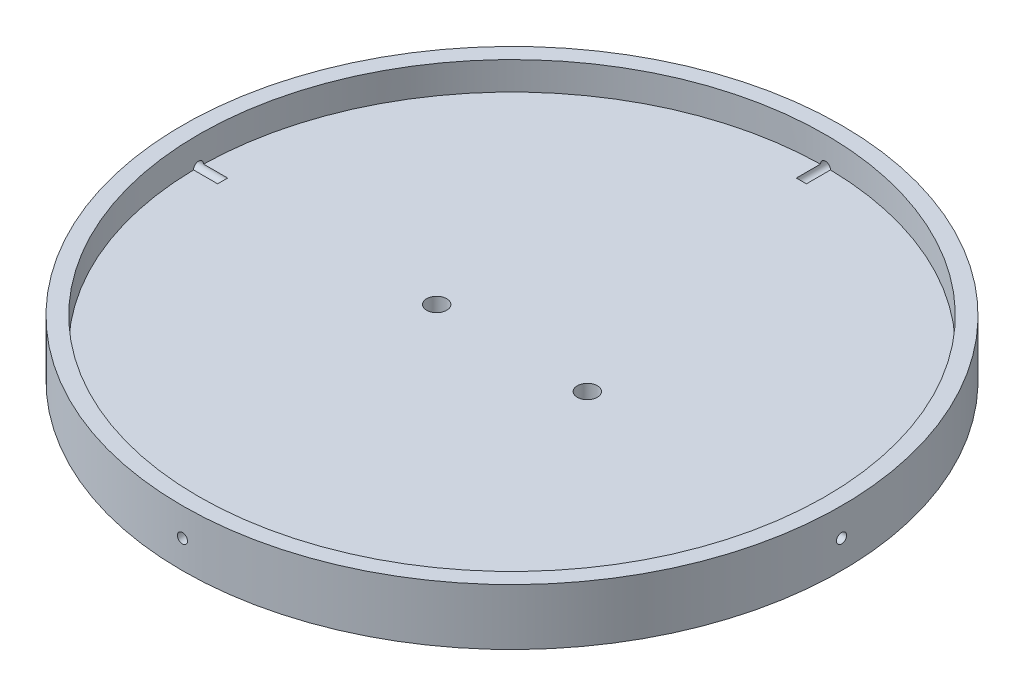
from build123d import *

# Parameters (mm, degrees)
SKETCH1_R           = 82
BOSS_EXTRUDE1_DEPTH = 7
SKETCH2_R           = 2.5
CUT_EXTRUDE1_DEPTH  = 10
SKETCH3_R           = 82
SKETCH3_R_2         = 78
BOSS_EXTRUDE2_DEPTH = 7
SKETCH4_R           = 1.25
CUT_EXTRUDE3_DEPTH  = 10
CIRPATTERN1_COUNT   = 4


with BuildPart() as part:
    # Sketch1 → Boss-Extrude1 (new body)
    with BuildSketch(Plane(origin=(0, 0, 0), x_dir=(1, 0, 0), z_dir=(0, 1, 0))):
        with Locations(Location((0, 0, 0), (0, 0, 270))):
            Circle(SKETCH1_R)
    extrude(amount=BOSS_EXTRUDE1_DEPTH)

    # Sketch2 → Cut-Extrude1 (cut)
    with BuildSketch(Plane(origin=(0, 7, 0), x_dir=(1, 0, 0), z_dir=(0, 1, 0))):
        with Locations(Location((-18.75, 0, 0), (0, 0, 270))):
            Circle(SKETCH2_R)
        with Locations(Location((18.75, 0, 0), (0, 0, 270))):
            Circle(SKETCH2_R)
    extrude(amount=-CUT_EXTRUDE1_DEPTH, mode=Mode.SUBTRACT)

    # Sketch3 → Boss-Extrude2 (add)
    with BuildSketch(Plane(origin=(0, 7, 0), x_dir=(1, 0, 0), z_dir=(0, 1, 0))):
        with Locations(Location((0, 0, 0), (0, 0, 270))):
            Circle(SKETCH3_R)
        with Locations(Location((0, 0, 0), (0, 0, 270))):
            Circle(SKETCH3_R_2, mode=Mode.SUBTRACT)
    extrude(amount=BOSS_EXTRUDE2_DEPTH)

    # Sketch4 → Cut-Extrude3 (cut)
    with BuildSketch(Plane(origin=(82, 0, 0), x_dir=(0, 0, -1), z_dir=(1, 0, 0))):
        with Locations((0, 7)):
            Circle(SKETCH4_R)
    cut_extrude3 = extrude(amount=-CUT_EXTRUDE3_DEPTH, mode=Mode.SUBTRACT)

    # CirPattern1: Cut-Extrude3 ×4 about axis
    cirpattern1_axis = Axis((0, 0, 0), (0, 1, 0))
    for i in range(1, CIRPATTERN1_COUNT):
        add(cut_extrude3.rotate(cirpattern1_axis, i * 360 / CIRPATTERN1_COUNT), mode=Mode.SUBTRACT)


solid = part.part
